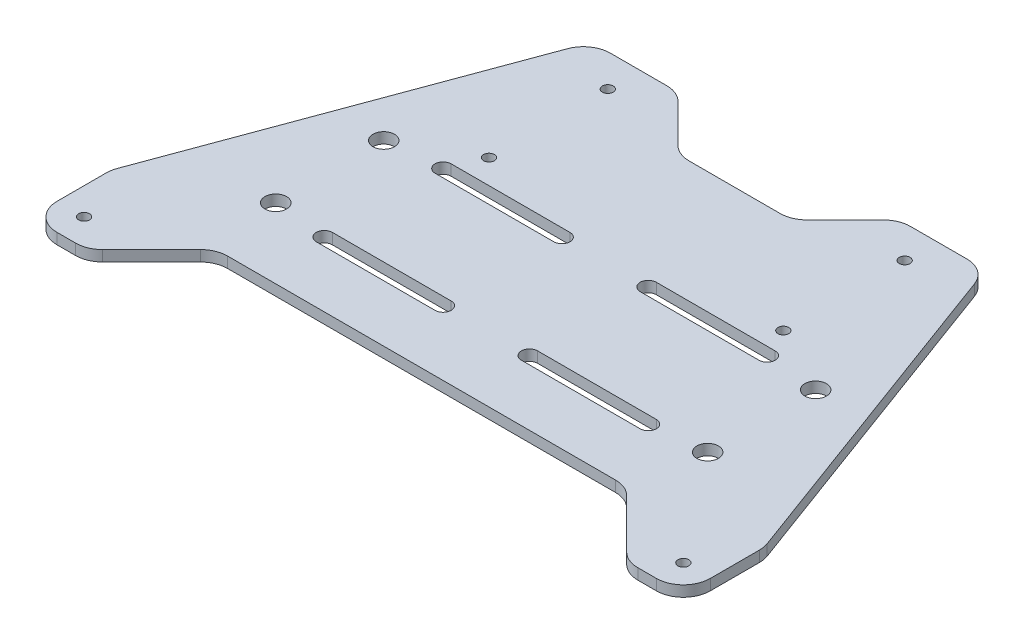
from build123d import *

# Parameters (mm, degrees)
SKETCH1_W                = 130
SKETCH1_H                = 90
BOSS_EXTRUDE2_DEPTH      = 2
SKETCH2_R                = 2
CUT_EXTRUDE1_DEPTH       = 10
CUT_EXTRUDE3_DEPTH       = 10
SKETCH5_R                = 1
CUT_EXTRUDE4_DEPTH       = 10
SKETCH7_W                = 130
SKETCH7_H                = 10
CUT_EXTRUDE5_DEPTH       = 10
CUT_EXTRUDE10_DEPTH      = 149.761308663
CUT_EXTRUDE10_DEPTH_BACK = 149.761308663
CUT_EXTRUDE14_DEPTH      = 149.761308663
CUT_EXTRUDE14_DEPTH_BACK = 13
SKETCH12_R               = 1
FILLET2_R                = 5


with BuildPart() as part:
    # Sketch1 → Boss-Extrude2 (new body)
    with BuildSketch(Plane(origin=(0, 0, 0), x_dir=(1, 0, 0), z_dir=(0, 1, 0))):
        with Locations((56.787418592, 40.403463793)):
            Rectangle(SKETCH1_W, SKETCH1_H)
    extrude(amount=BOSS_EXTRUDE2_DEPTH)

    # Sketch2 → Cut-Extrude1 (cut)
    with BuildSketch(Plane(origin=(0, 2, 0), x_dir=(1, 0, 0), z_dir=(0, 1, 0))):
        with Locations(Location((16.787418592, 50.403463793, 0), (0, 0, 270))):
            Circle(SKETCH2_R)
        with Locations(Location((16.787418592, 30.403463793, 0), (0, 0, 270))):
            Circle(SKETCH2_R)
        with Locations(Location((96.787418592, 50.403463793, 0), (0, 0, 270))):
            Circle(SKETCH2_R)
        with Locations(Location((96.787418592, 30.403463793, 0), (0, 0, 270))):
            Circle(SKETCH2_R)
    extrude(amount=-CUT_EXTRUDE1_DEPTH, mode=Mode.SUBTRACT)

    # Sketch4 → Cut-Extrude3 (cut)
    with BuildSketch(Plane(origin=(0, 2, 0), x_dir=(1, 0, 0), z_dir=(0, 1, 0))):
        with BuildLine():
            Line((26.787418592, 52.903463793), (48.787418592, 52.903463793))
            ThreePointArc((48.787418592, 52.903463793), (50.287418592, 51.403463793), (48.787418592, 49.903463793))
            Line((48.787418592, 49.903463793), (26.787418592, 49.903463793))
            ThreePointArc((26.787418592, 49.903463793), (25.287418592, 51.403463793), (26.787418592, 52.903463793))
        make_face()
        with BuildLine():
            Line((26.787418592, 30.903463793), (48.787418592, 30.903463793))
            ThreePointArc((48.787418592, 30.903463793), (50.287418592, 29.403463793), (48.787418592, 27.903463793))
            Line((48.787418592, 27.903463793), (26.787418592, 27.903463793))
            ThreePointArc((26.787418592, 27.903463793), (25.287418592, 29.403463793), (26.787418592, 30.903463793))
        make_face()
        with BuildLine():
            Line((64.787418592, 52.903463793), (86.787418592, 52.903463793))
            ThreePointArc((86.787418592, 52.903463793), (88.287418592, 51.403463793), (86.787418592, 49.903463793))
            Line((86.787418592, 49.903463793), (64.787418592, 49.903463793))
            ThreePointArc((64.787418592, 49.903463793), (63.287418592, 51.403463793), (64.787418592, 52.903463793))
        make_face()
        with BuildLine():
            Line((64.787418592, 30.903463793), (86.787418592, 30.903463793))
            ThreePointArc((86.787418592, 30.903463793), (88.287418592, 29.403463793), (86.787418592, 27.903463793))
            Line((86.787418592, 27.903463793), (64.787418592, 27.903463793))
            ThreePointArc((64.787418592, 27.903463793), (63.287418592, 29.403463793), (64.787418592, 30.903463793))
        make_face()
    extrude(amount=-CUT_EXTRUDE3_DEPTH, mode=Mode.SUBTRACT)

    # Sketch5 → Cut-Extrude4 (cut)
    with BuildSketch(Plane(origin=(0, 2, 0), x_dir=(1, 0, 0), z_dir=(0, 1, 0))):
        with Locations(Location((1.287418592, 10.403463793, 0), (0, 0, 270))):
            Circle(SKETCH5_R)
        with Locations(Location((112.287418592, 10.403463793, 0), (0, 0, 270))):
            Circle(SKETCH5_R)
        with Locations(Location((84.287418592, 56.920801797, 0), (0, 0, 270))):
            Circle(SKETCH5_R)
        with Locations(Location((116.787418592, 57.403463793, 0), (0, 0, 270))):
            Circle(SKETCH5_R)
        with Locations(Location((116.787418592, 79.403463793, 0), (0, 0, 270))):
            Circle(SKETCH5_R)
        with Locations(Location((84.287418592, 79.403463793, 0), (0, 0, 270))):
            Circle(SKETCH5_R)
        with Locations(Location((-3.212581408, 57.403463793, 0), (0, 0, 270))):
            Circle(SKETCH5_R)
        with Locations(Location((29.287418592, 57.403463793, 0), (0, 0, 270))):
            Circle(SKETCH5_R)
        with Locations(Location((29.287418592, 79.403463793, 0), (0, 0, 270))):
            Circle(SKETCH5_R)
        with Locations(Location((-3.212581408, 79.403463793, 0), (0, 0, 270))):
            Circle(SKETCH5_R)
    extrude(amount=-CUT_EXTRUDE4_DEPTH, mode=Mode.SUBTRACT)

    # Sketch7 → Cut-Extrude5 (cut)
    with BuildSketch(Plane(origin=(0, 2, 0), x_dir=(1, 0, 0), z_dir=(0, 1, 0))):
        with Locations((56.787418592, 0.403463793)):
            Rectangle(SKETCH7_W, SKETCH7_H)
    extrude(amount=-CUT_EXTRUDE5_DEPTH, mode=Mode.SUBTRACT)

    # Sketch9 → Cut-Extrude10 (cut, two sides: drawn at the far end of the back side and taken through both)
    with BuildSketch(Plane(origin=(0, 2, 0), x_dir=(1, 0, 0), z_dir=(0, 1, 0)).offset(-CUT_EXTRUDE10_DEPTH_BACK)):
        Polygon((-198.399776781, -199.78373158), (6.787418592, 5.403463793), (18.787418592, 17.403463793), (94.787418592, 17.403463793), (106.787418592, 5.403463793), (311.974613966, -199.78373158), (311.974613966, -780.140760625), (-198.399776781, -780.140760625), align=None)
    extrude(amount=CUT_EXTRUDE10_DEPTH + CUT_EXTRUDE10_DEPTH_BACK, mode=Mode.SUBTRACT)

    # Sketch12 → Cut-Extrude14 (cut, two sides: drawn at the far end of the back side and taken through both)
    # profile 1 of 3: a face of its own
    with BuildSketch(Plane(origin=(0, 2, 0), x_dir=(1, 0, 0), z_dir=(0, 1, 0)).offset(-CUT_EXTRUDE14_DEPTH_BACK)):
        Polygon((-8.212581408, 5.403463793), (-3.712581408, 5.403463793), (-3.712581408, 20.403463793), (20.287418592, 85.403463793), (-8.212581408, 85.403463793), align=None)
        with Locations((-3.212581408, 57.403463793)):
            Circle(SKETCH12_R, mode=Mode.SUBTRACT)
        with Locations((-3.212581408, 79.403463793)):
            Circle(SKETCH12_R, mode=Mode.SUBTRACT)
    # profile 2 of 3: a face of its own
    with BuildSketch(Plane(origin=(0, 2, 0), x_dir=(1, 0, 0), z_dir=(0, 1, 0)).offset(-CUT_EXTRUDE14_DEPTH_BACK)):
        Polygon((77.287418592, 85.403463793), (36.287418592, 85.403463793), (46.287418592, 75.403463793), (67.287418592, 75.403463793), align=None)
    # profile 3 of 3: a face of its own
    with BuildSketch(Plane(origin=(0, 2, 0), x_dir=(1, 0, 0), z_dir=(0, 1, 0)).offset(-CUT_EXTRUDE14_DEPTH_BACK)):
        Polygon((121.787418592, 85.403463793), (93.287418592, 85.403463793), (117.287418592, 20.403463793), (117.287418592, 5.403463793), (121.787418592, 5.403463793), align=None)
        with Locations((116.787418592, 57.403463793)):
            Circle(SKETCH12_R, mode=Mode.SUBTRACT)
        with Locations((116.787418592, 79.403463793)):
            Circle(SKETCH12_R, mode=Mode.SUBTRACT)
    extrude(amount=CUT_EXTRUDE14_DEPTH + CUT_EXTRUDE14_DEPTH_BACK, mode=Mode.SUBTRACT)

    # Fillet2
    fillet2_edges = [part.edges().sort_by_distance(p)[0] for p in [
        (-3.712581408, 1, -5.403463793),
        (-3.712581408, 1, -20.403463793),
        (18.787418592, 1, -17.403463793),
        (6.787418592, 1, -5.403463793),
        (94.787418592, 1, -17.403463793),
        (106.787418592, 1, -5.403463793),
        (117.287418592, 1, -5.403463793),
        (117.287418592, 1, -20.403463793),
        (93.287418592, 1, -85.403463793),
        (20.287418592, 1, -85.403463793),
        (36.287418592, 1, -85.403463793),
        (46.287418592, 1, -75.403463793),
        (67.287418592, 1, -75.403463793),
        (77.287418592, 1, -85.403463793),
    ]]
    fillet(fillet2_edges, radius=FILLET2_R)


solid = part.part
